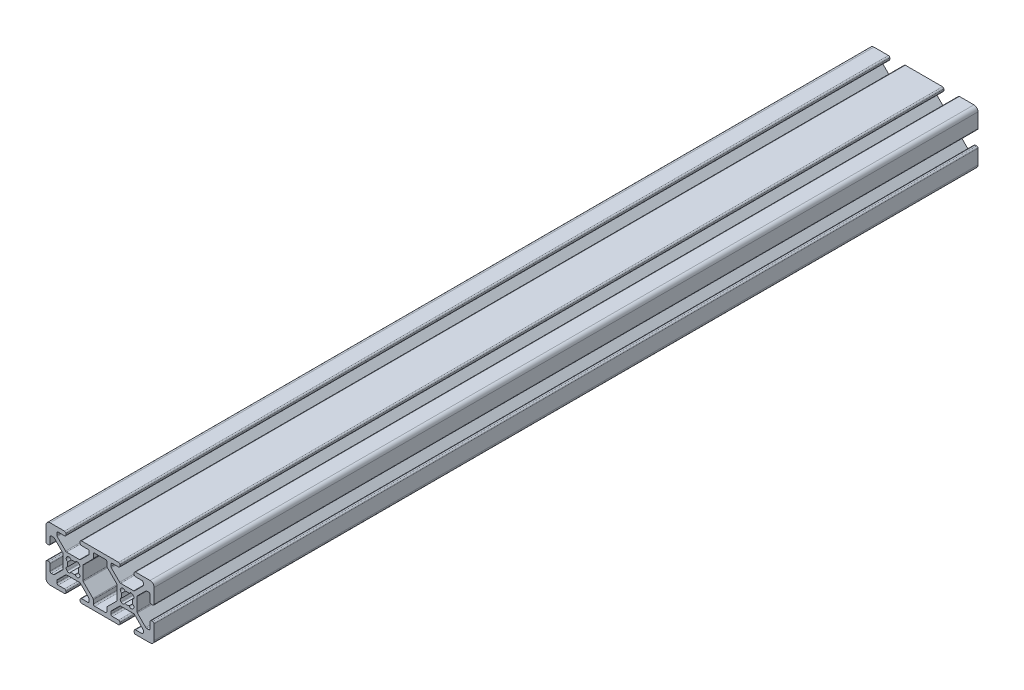
from build123d import *

# Parameters (mm, degrees)
EXTRUDE1_DEPTH = 304.8


with BuildPart() as part:
    # Sketch1 → Extrude1 (new body)
    with BuildSketch(Plane.XY):
        with BuildLine():
            Line((-36.908207136, -63.334998016), (-32.140368459, -63.334998016))
            ThreePointArc((-32.140368459, -63.334998016), (-31.945965275, -63.373667213), (-31.781158214, -63.483787771))
            Line((-31.781158214, -63.483787771), (-28.678077553, -66.586868432))
            ThreePointArc((-28.678077553, -66.586868432), (-28.567956995, -66.751675493), (-28.529287798, -66.946078677))
            Line((-28.529287798, -66.946078677), (-28.529287798, -67.671998016))
            ThreePointArc((-28.529287798, -67.671998016), (-28.678077553, -68.03120826), (-29.037287798, -68.179998016))
            Line((-29.037287798, -68.179998016), (-31.386287798, -68.179998016))
            ThreePointArc((-31.386287798, -68.179998016), (-31.745498042, -68.328787771), (-31.894287798, -68.687998016))
            Line((-31.894287798, -68.687998016), (-31.894287798, -69.171998016))
            ThreePointArc((-31.894287798, -69.171998016), (-31.745498042, -69.53120826), (-31.386287798, -69.679998016))
            Line((-31.386287798, -69.679998016), (-17.662287798, -69.679998016))
            ThreePointArc((-17.662287798, -69.679998016), (-17.303077553, -69.53120826), (-17.154287798, -69.171998016))
            Line((-17.154287798, -69.171998016), (-17.154287798, -68.687998016))
            ThreePointArc((-17.154287798, -68.687998016), (-17.303077553, -68.328787771), (-17.662287798, -68.179998016))
            Line((-17.662287798, -68.179998016), (-20.011287798, -68.179998016))
            ThreePointArc((-20.011287798, -68.179998016), (-20.370498042, -68.03120826), (-20.519287798, -67.671998016))
            Line((-20.519287798, -67.671998016), (-20.519287798, -66.946078677))
            ThreePointArc((-20.519287798, -66.946078677), (-20.4806186, -66.751675493), (-20.370498042, -66.586868432))
            Line((-20.370498042, -66.586868432), (-17.267417381, -63.483787771))
            ThreePointArc((-17.267417381, -63.483787771), (-17.10261032, -63.373667213), (-16.908207136, -63.334998016))
            Line((-16.908207136, -63.334998016), (-12.140368459, -63.334998016))
            ThreePointArc((-12.140368459, -63.334998016), (-11.945965275, -63.373667213), (-11.781158214, -63.483787771))
            Line((-11.781158214, -63.483787771), (-8.678077553, -66.586868432))
            ThreePointArc((-8.678077553, -66.586868432), (-8.567956995, -66.751675493), (-8.529287798, -66.946078677))
            Line((-8.529287798, -66.946078677), (-8.529287798, -67.671998016))
            ThreePointArc((-8.529287798, -67.671998016), (-8.678077553, -68.03120826), (-9.037287798, -68.179998016))
            Line((-9.037287798, -68.179998016), (-11.386287798, -68.179998016))
            ThreePointArc((-11.386287798, -68.179998016), (-11.745498042, -68.328787771), (-11.894287798, -68.687998016))
            Line((-11.894287798, -68.687998016), (-11.894287798, -69.171998016))
            ThreePointArc((-11.894287798, -69.171998016), (-11.745498042, -69.53120826), (-11.386287798, -69.679998016))
            Line((-11.386287798, -69.679998016), (-6.024287798, -69.679998016))
            ThreePointArc((-6.024287798, -69.679998016), (-4.963627626, -69.240658187), (-4.524287798, -68.179998016))
            Line((-4.524287798, -68.179998016), (-4.524287798, -62.817998016))
            ThreePointArc((-4.524287798, -62.817998016), (-4.673077553, -62.458787771), (-5.032287798, -62.309998016))
            Line((-5.032287798, -62.309998016), (-5.516287798, -62.309998016))
            ThreePointArc((-5.516287798, -62.309998016), (-5.875498042, -62.458787771), (-6.024287798, -62.817998016))
            Line((-6.024287798, -62.817998016), (-6.024287798, -65.166998016))
            ThreePointArc((-6.024287798, -65.166998016), (-6.173077553, -65.52620826), (-6.532287798, -65.674998016))
            Line((-6.532287798, -65.674998016), (-7.258207136, -65.674998016))
            ThreePointArc((-7.258207136, -65.674998016), (-7.45261032, -65.636328818), (-7.617417381, -65.52620826))
            Line((-7.617417381, -65.52620826), (-10.720498042, -62.423127599))
            ThreePointArc((-10.720498042, -62.423127599), (-10.8306186, -62.258320538), (-10.869287798, -62.063917354))
            Line((-10.869287798, -62.063917354), (-10.869287798, -57.296078677))
            ThreePointArc((-10.869287798, -57.296078677), (-10.8306186, -57.101675493), (-10.720498042, -56.936868432))
            Line((-10.720498042, -56.936868432), (-7.617417381, -53.833787771))
            ThreePointArc((-7.617417381, -53.833787771), (-7.45261032, -53.723667213), (-7.258207136, -53.684998016))
            Line((-7.258207136, -53.684998016), (-6.532287798, -53.684998016))
            ThreePointArc((-6.532287798, -53.684998016), (-6.173077553, -53.833787771), (-6.024287798, -54.192998016))
            Line((-6.024287798, -54.192998016), (-6.024287798, -56.541998016))
            ThreePointArc((-6.024287798, -56.541998016), (-5.875498042, -56.90120826), (-5.516287798, -57.049998016))
            Line((-5.516287798, -57.049998016), (-5.032287798, -57.049998016))
            ThreePointArc((-5.032287798, -57.049998016), (-4.673077553, -56.90120826), (-4.524287798, -56.541998016))
            Line((-4.524287798, -56.541998016), (-4.524287798, -51.179998016))
            ThreePointArc((-4.524287798, -51.179998016), (-4.963627626, -50.119337844), (-6.024287798, -49.679998016))
            Line((-6.024287798, -49.679998016), (-11.386287798, -49.679998016))
            ThreePointArc((-11.386287798, -49.679998016), (-11.745498042, -49.828787771), (-11.894287798, -50.187998016))
            Line((-11.894287798, -50.187998016), (-11.894287798, -50.671998016))
            ThreePointArc((-11.894287798, -50.671998016), (-11.745498042, -51.03120826), (-11.386287798, -51.179998016))
            Line((-11.386287798, -51.179998016), (-9.037287798, -51.179998016))
            ThreePointArc((-9.037287798, -51.179998016), (-8.678077553, -51.328787771), (-8.529287798, -51.687998016))
            Line((-8.529287798, -51.687998016), (-8.529287798, -52.413917354))
            ThreePointArc((-8.529287798, -52.413917354), (-8.567956995, -52.608320538), (-8.678077553, -52.773127599))
            Line((-8.678077553, -52.773127599), (-11.781158214, -55.87620826))
            ThreePointArc((-11.781158214, -55.87620826), (-11.945965275, -55.986328818), (-12.140368459, -56.024998016))
            Line((-12.140368459, -56.024998016), (-16.908207136, -56.024998016))
            ThreePointArc((-16.908207136, -56.024998016), (-17.10261032, -55.986328818), (-17.267417381, -55.87620826))
            Line((-17.267417381, -55.87620826), (-20.370498042, -52.773127599))
            ThreePointArc((-20.370498042, -52.773127599), (-20.4806186, -52.608320538), (-20.519287798, -52.413917354))
            Line((-20.519287798, -52.413917354), (-20.519287798, -51.687998016))
            ThreePointArc((-20.519287798, -51.687998016), (-20.370498042, -51.328787771), (-20.011287798, -51.179998016))
            Line((-20.011287798, -51.179998016), (-17.662287798, -51.179998016))
            ThreePointArc((-17.662287798, -51.179998016), (-17.303077553, -51.03120826), (-17.154287798, -50.671998016))
            Line((-17.154287798, -50.671998016), (-17.154287798, -50.187998016))
            ThreePointArc((-17.154287798, -50.187998016), (-17.303077553, -49.828787771), (-17.662287798, -49.679998016))
            Line((-17.662287798, -49.679998016), (-31.386287798, -49.679998016))
            ThreePointArc((-31.386287798, -49.679998016), (-31.745498042, -49.828787771), (-31.894287798, -50.187998016))
            Line((-31.894287798, -50.187998016), (-31.894287798, -50.671998016))
            ThreePointArc((-31.894287798, -50.671998016), (-31.745498042, -51.03120826), (-31.386287798, -51.179998016))
            Line((-31.386287798, -51.179998016), (-29.037287798, -51.179998016))
            ThreePointArc((-29.037287798, -51.179998016), (-28.678077553, -51.328787771), (-28.529287798, -51.687998016))
            Line((-28.529287798, -51.687998016), (-28.529287798, -52.413917354))
            ThreePointArc((-28.529287798, -52.413917354), (-28.567956995, -52.608320538), (-28.678077553, -52.773127599))
            Line((-28.678077553, -52.773127599), (-31.781158214, -55.87620826))
            ThreePointArc((-31.781158214, -55.87620826), (-31.945965275, -55.986328818), (-32.140368459, -56.024998016))
            Line((-32.140368459, -56.024998016), (-36.908207136, -56.024998016))
            ThreePointArc((-36.908207136, -56.024998016), (-37.10261032, -55.986328818), (-37.267417381, -55.87620826))
            Line((-37.267417381, -55.87620826), (-40.370498042, -52.773127599))
            ThreePointArc((-40.370498042, -52.773127599), (-40.4806186, -52.608320538), (-40.519287798, -52.413917354))
            Line((-40.519287798, -52.413917354), (-40.519287798, -51.687998016))
            ThreePointArc((-40.519287798, -51.687998016), (-40.370498042, -51.328787771), (-40.011287798, -51.179998016))
            Line((-40.011287798, -51.179998016), (-37.662287798, -51.179998016))
            ThreePointArc((-37.662287798, -51.179998016), (-37.303077553, -51.03120826), (-37.154287798, -50.671998016))
            Line((-37.154287798, -50.671998016), (-37.154287798, -50.187998016))
            ThreePointArc((-37.154287798, -50.187998016), (-37.303077553, -49.828787771), (-37.662287798, -49.679998016))
            Line((-37.662287798, -49.679998016), (-43.024287798, -49.679998016))
            ThreePointArc((-43.024287798, -49.679998016), (-44.084947969, -50.119337844), (-44.524287798, -51.179998016))
            Line((-44.524287798, -51.179998016), (-44.524287798, -56.541998016))
            ThreePointArc((-44.524287798, -56.541998016), (-44.375498042, -56.90120826), (-44.016287798, -57.049998016))
            Line((-44.016287798, -57.049998016), (-43.532287798, -57.049998016))
            ThreePointArc((-43.532287798, -57.049998016), (-43.173077553, -56.90120826), (-43.024287798, -56.541998016))
            Line((-43.024287798, -56.541998016), (-43.024287798, -54.192998016))
            ThreePointArc((-43.024287798, -54.192998016), (-42.875498042, -53.833787771), (-42.516287798, -53.684998016))
            Line((-42.516287798, -53.684998016), (-41.790368459, -53.684998016))
            ThreePointArc((-41.790368459, -53.684998016), (-41.595965275, -53.723667213), (-41.431158214, -53.833787771))
            Line((-41.431158214, -53.833787771), (-38.328077553, -56.936868432))
            ThreePointArc((-38.328077553, -56.936868432), (-38.217956995, -57.101675493), (-38.179287798, -57.296078677))
            Line((-38.179287798, -57.296078677), (-38.179287798, -62.063917354))
            ThreePointArc((-38.179287798, -62.063917354), (-38.217956995, -62.258320538), (-38.328077553, -62.423127599))
            Line((-38.328077553, -62.423127599), (-41.431158214, -65.52620826))
            ThreePointArc((-41.431158214, -65.52620826), (-41.595965275, -65.636328818), (-41.790368459, -65.674998016))
            Line((-41.790368459, -65.674998016), (-42.516287798, -65.674998016))
            ThreePointArc((-42.516287798, -65.674998016), (-42.875498042, -65.52620826), (-43.024287798, -65.166998016))
            Line((-43.024287798, -65.166998016), (-43.024287798, -62.817998016))
            ThreePointArc((-43.024287798, -62.817998016), (-43.173077553, -62.458787771), (-43.532287798, -62.309998016))
            Line((-43.532287798, -62.309998016), (-44.016287798, -62.309998016))
            ThreePointArc((-44.016287798, -62.309998016), (-44.375498042, -62.458787771), (-44.524287798, -62.817998016))
            Line((-44.524287798, -62.817998016), (-44.524287798, -68.179998016))
            ThreePointArc((-44.524287798, -68.179998016), (-44.084947969, -69.240658187), (-43.024287798, -69.679998016))
            Line((-43.024287798, -69.679998016), (-37.662287798, -69.679998016))
            ThreePointArc((-37.662287798, -69.679998016), (-37.303077553, -69.53120826), (-37.154287798, -69.171998016))
            Line((-37.154287798, -69.171998016), (-37.154287798, -68.687998016))
            ThreePointArc((-37.154287798, -68.687998016), (-37.303077553, -68.328787771), (-37.662287798, -68.179998016))
            Line((-37.662287798, -68.179998016), (-40.011287798, -68.179998016))
            ThreePointArc((-40.011287798, -68.179998016), (-40.370498042, -68.03120826), (-40.519287798, -67.671998016))
            Line((-40.519287798, -67.671998016), (-40.519287798, -66.946078677))
            ThreePointArc((-40.519287798, -66.946078677), (-40.4806186, -66.751675493), (-40.370498042, -66.586868432))
            Line((-40.370498042, -66.586868432), (-37.267417381, -63.483787771))
            ThreePointArc((-37.267417381, -63.483787771), (-37.10261032, -63.373667213), (-36.908207136, -63.334998016))
        make_face()
        with BuildLine():
            Line((-16.649188641, -61.984503982), (-16.828793764, -61.804898859))
            ThreePointArc((-16.828793764, -61.804898859), (-17.030225814, -61.036465826), (-16.459421304, -60.483974734))
            ThreePointArc((-16.459421304, -60.483974734), (-16.619787798, -59.679998016), (-16.459421304, -58.876021298))
            ThreePointArc((-16.459421304, -58.876021298), (-17.030225814, -58.323530205), (-16.828793764, -57.555097172))
            Line((-16.828793764, -57.555097172), (-16.649188641, -57.375492049))
            ThreePointArc((-16.649188641, -57.375492049), (-15.880755608, -57.174059999), (-15.328264516, -57.744864509))
            ThreePointArc((-15.328264516, -57.744864509), (-14.524287798, -57.584498016), (-13.72031108, -57.744864509))
            ThreePointArc((-13.72031108, -57.744864509), (-13.167819987, -57.174059999), (-12.399386954, -57.375492049))
            Line((-12.399386954, -57.375492049), (-12.219781831, -57.555097172))
            ThreePointArc((-12.219781831, -57.555097172), (-12.018349781, -58.323530205), (-12.589154291, -58.876021298))
            ThreePointArc((-12.589154291, -58.876021298), (-12.428787798, -59.679998016), (-12.589154291, -60.483974734))
            ThreePointArc((-12.589154291, -60.483974734), (-12.018349781, -61.036465826), (-12.219781831, -61.804898859))
            Line((-12.219781831, -61.804898859), (-12.399386954, -61.984503982))
            ThreePointArc((-12.399386954, -61.984503982), (-13.167819987, -62.185936032), (-13.72031108, -61.615131522))
            ThreePointArc((-13.72031108, -61.615131522), (-14.524287798, -61.775498016), (-15.328264516, -61.615131522))
            ThreePointArc((-15.328264516, -61.615131522), (-15.880755608, -62.185936032), (-16.649188641, -61.984503982))
        make_face(mode=Mode.SUBTRACT)
        with BuildLine():
            Line((-27.029287798, -67.671998016), (-27.029287798, -66.324758333))
            ThreePointArc((-27.029287798, -66.324758333), (-27.067956995, -66.13035515), (-27.178077553, -65.965548089))
            Line((-27.178077553, -65.965548089), (-30.720498042, -62.423127599))
            ThreePointArc((-30.720498042, -62.423127599), (-30.8306186, -62.258320538), (-30.869287798, -62.063917354))
            Line((-30.869287798, -62.063917354), (-30.869287798, -57.296078677))
            ThreePointArc((-30.869287798, -57.296078677), (-30.8306186, -57.101675493), (-30.720498042, -56.936868432))
            Line((-30.720498042, -56.936868432), (-27.178077553, -53.394447942))
            ThreePointArc((-27.178077553, -53.394447942), (-27.067956995, -53.229640881), (-27.029287798, -53.035237698))
            Line((-27.029287798, -53.035237698), (-27.029287798, -51.687998016))
            ThreePointArc((-27.029287798, -51.687998016), (-26.880498042, -51.328787771), (-26.521287798, -51.179998016))
            Line((-26.521287798, -51.179998016), (-22.527287798, -51.179998016))
            ThreePointArc((-22.527287798, -51.179998016), (-22.168077553, -51.328787771), (-22.019287798, -51.687998016))
            Line((-22.019287798, -51.687998016), (-22.019287798, -53.035237698))
            ThreePointArc((-22.019287798, -53.035237698), (-21.9806186, -53.229640881), (-21.870498042, -53.394447942))
            Line((-21.870498042, -53.394447942), (-18.328077553, -56.936868432))
            ThreePointArc((-18.328077553, -56.936868432), (-18.217956995, -57.101675493), (-18.179287798, -57.296078677))
            Line((-18.179287798, -57.296078677), (-18.179287798, -62.063917354))
            ThreePointArc((-18.179287798, -62.063917354), (-18.217956995, -62.258320538), (-18.328077553, -62.423127599))
            Line((-18.328077553, -62.423127599), (-21.870498042, -65.965548089))
            ThreePointArc((-21.870498042, -65.965548089), (-21.9806186, -66.13035515), (-22.019287798, -66.324758333))
            Line((-22.019287798, -66.324758333), (-22.019287798, -67.671998016))
            ThreePointArc((-22.019287798, -67.671998016), (-22.168077553, -68.03120826), (-22.527287798, -68.179998016))
            Line((-22.527287798, -68.179998016), (-26.521287798, -68.179998016))
            ThreePointArc((-26.521287798, -68.179998016), (-26.880498042, -68.03120826), (-27.029287798, -67.671998016))
        make_face(mode=Mode.SUBTRACT)
        with BuildLine():
            Line((-36.649188641, -61.984503982), (-36.828793764, -61.804898859))
            ThreePointArc((-36.828793764, -61.804898859), (-37.030225814, -61.036465826), (-36.459421304, -60.483974734))
            ThreePointArc((-36.459421304, -60.483974734), (-36.619787798, -59.679998016), (-36.459421304, -58.876021298))
            ThreePointArc((-36.459421304, -58.876021298), (-37.030225814, -58.323530205), (-36.828793764, -57.555097172))
            Line((-36.828793764, -57.555097172), (-36.649188641, -57.375492049))
            ThreePointArc((-36.649188641, -57.375492049), (-35.880755608, -57.174059999), (-35.328264516, -57.744864509))
            ThreePointArc((-35.328264516, -57.744864509), (-34.524287798, -57.584498016), (-33.72031108, -57.744864509))
            ThreePointArc((-33.72031108, -57.744864509), (-33.167819987, -57.174059999), (-32.399386954, -57.375492049))
            Line((-32.399386954, -57.375492049), (-32.219781831, -57.555097172))
            ThreePointArc((-32.219781831, -57.555097172), (-32.018349781, -58.323530205), (-32.589154291, -58.876021298))
            ThreePointArc((-32.589154291, -58.876021298), (-32.428787798, -59.679998016), (-32.589154291, -60.483974734))
            ThreePointArc((-32.589154291, -60.483974734), (-32.018349781, -61.036465826), (-32.219781831, -61.804898859))
            Line((-32.219781831, -61.804898859), (-32.399386954, -61.984503982))
            ThreePointArc((-32.399386954, -61.984503982), (-33.167819987, -62.185936032), (-33.72031108, -61.615131522))
            ThreePointArc((-33.72031108, -61.615131522), (-34.524287798, -61.775498016), (-35.328264516, -61.615131522))
            ThreePointArc((-35.328264516, -61.615131522), (-35.880755608, -62.185936032), (-36.649188641, -61.984503982))
        make_face(mode=Mode.SUBTRACT)
    extrude(amount=EXTRUDE1_DEPTH)


solid = part.part
